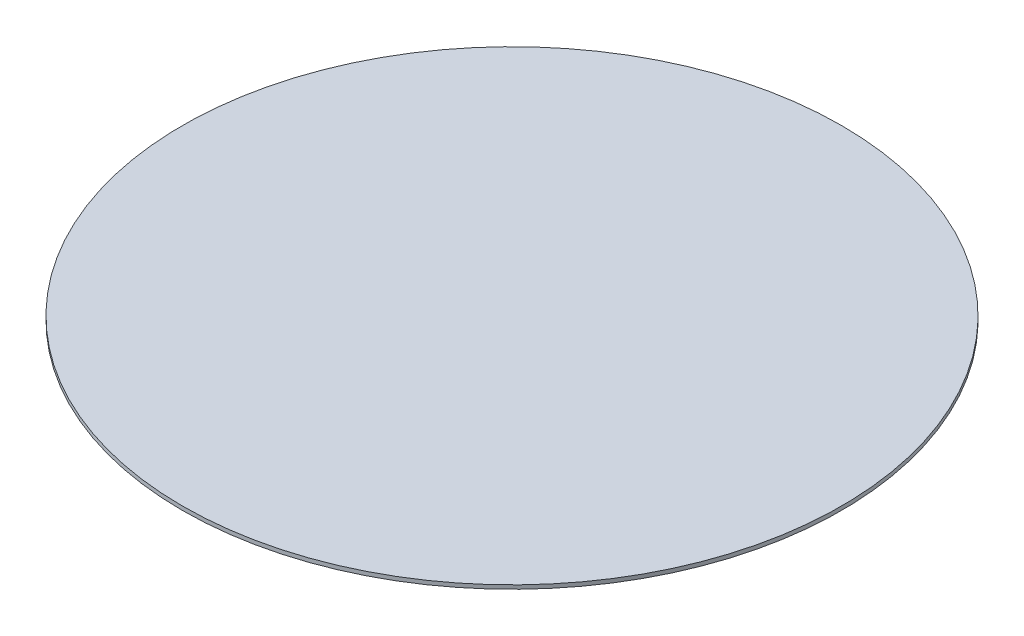
from build123d import *

# Parameters (mm, degrees)
SKETCH1_R           = 10.843749966
BOSS_EXTRUDE1_DEPTH = 0.127


with BuildPart() as part:
    # Sketch1 → Boss-Extrude1 (new body)
    with BuildSketch(Plane(origin=(0, 0, 0), x_dir=(1, 0, 0), z_dir=(0, 1, 0))):
        with Locations(Location((0, 0, 0), (0, 0, 270))):
            Circle(SKETCH1_R)
    extrude(amount=BOSS_EXTRUDE1_DEPTH)


solid = part.part
